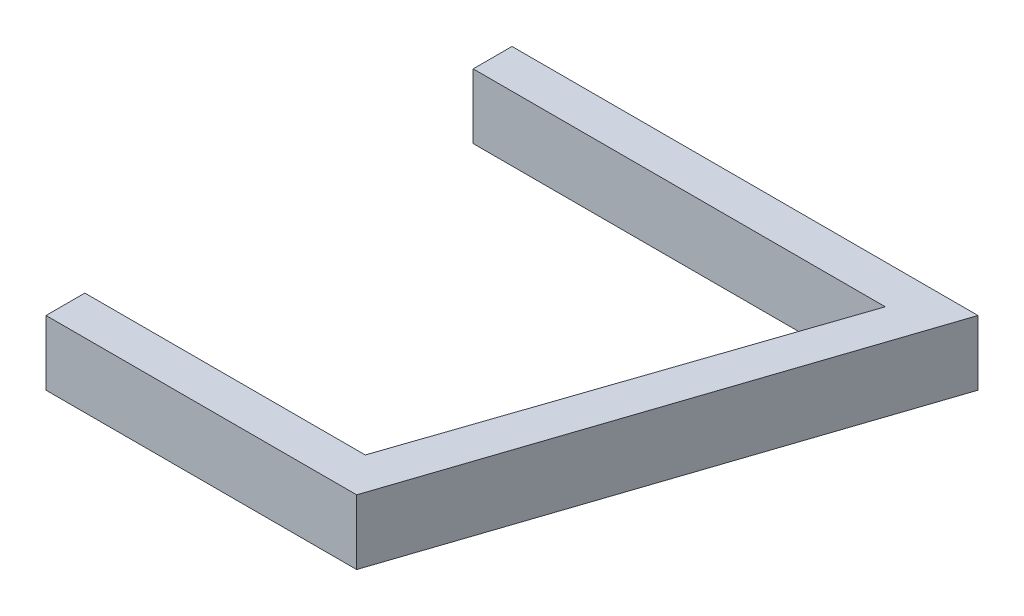
from build123d import *

# Parameters (mm, degrees)
BOSS_EXTRUDE1_DEPTH = 63.5


with BuildPart() as part:
    # Sketch1 → Boss-Extrude1 (new body)
    with BuildSketch(Plane(origin=(0, 0, 0), x_dir=(1, 0, 0), z_dir=(0, 1, 0))):
        Polygon((-228.6, 0), (228.6, 0), (76.2, -457.2), (-228.6, -457.2), (-228.6, -419.1), (46.566666667, -419.1), (175.739073716, -38.1), (-228.6, -38.1), align=None)
    extrude(amount=BOSS_EXTRUDE1_DEPTH)


solid = part.part
